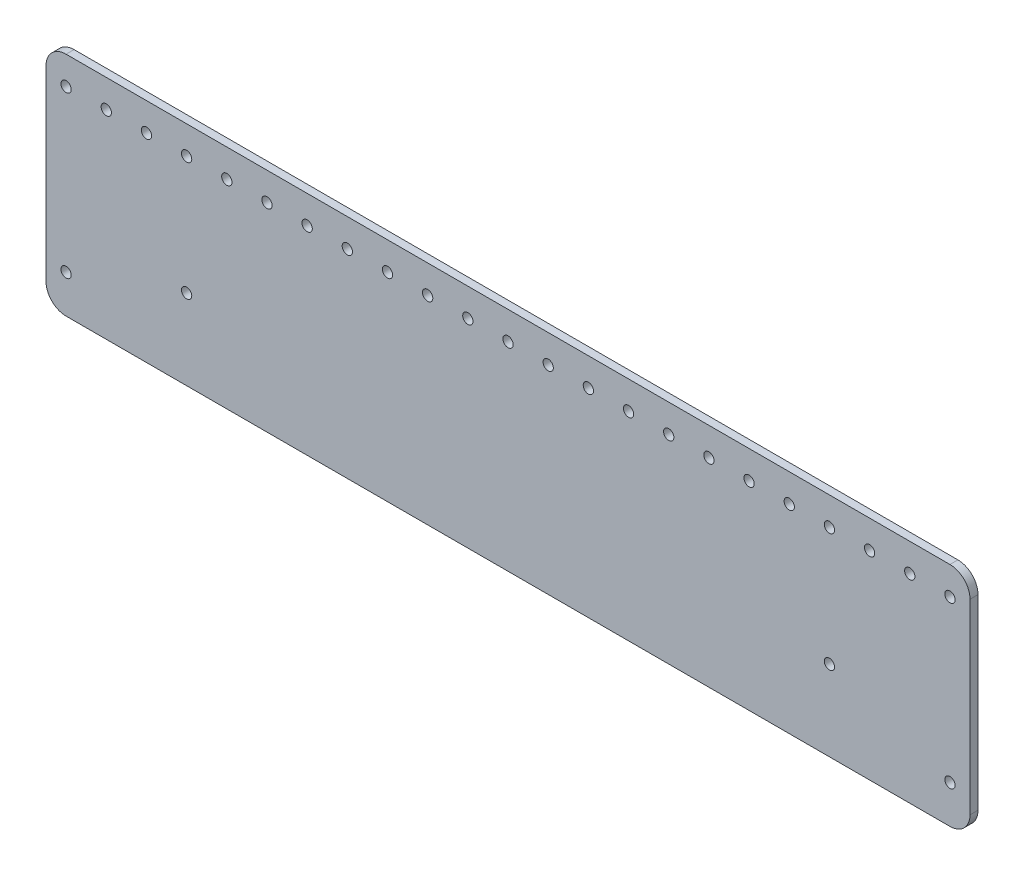
from build123d import *

# Parameters (mm, degrees)
SKETCH1_W           = 368
SKETCH1_H           = 90.35
SKETCH1_R           = 2.05
BOSS_EXTRUDE1_DEPTH = 3.175
SKETCH3_R           = 2.05
CUT_EXTRUDE1_DEPTH  = 3.18
FILLET1_R           = 8


with BuildPart() as part:
    # Sketch1 → Boss-Extrude1 (new body)
    with BuildSketch(Plane.XY):
        Rectangle(SKETCH1_W, SKETCH1_H)
        with Locations((-128, -13.175)):
            Circle(SKETCH1_R, mode=Mode.SUBTRACT)
        with Locations(Location((128, -13.175, 0), (0, 0, 180))):
            Circle(SKETCH1_R, mode=Mode.SUBTRACT)
    extrude(amount=BOSS_EXTRUDE1_DEPTH)

    # Sketch3 → Cut-Extrude1 (cut)
    with BuildSketch(Plane.XY.offset(3.175)):
        with Locations((-176, 34)):
            Circle(SKETCH3_R)
        with Locations((-160, 34)):
            Circle(SKETCH3_R)
        with Locations((-144, 34)):
            Circle(SKETCH3_R)
        with Locations((-128, 34)):
            Circle(SKETCH3_R)
        with Locations((-112, 34)):
            Circle(SKETCH3_R)
        with Locations((-96, 34)):
            Circle(SKETCH3_R)
        with Locations((-80, 34)):
            Circle(SKETCH3_R)
        with Locations((-64, 34)):
            Circle(SKETCH3_R)
        with Locations((-48, 34)):
            Circle(SKETCH3_R)
        with Locations((-32, 34)):
            Circle(SKETCH3_R)
        with Locations((-16, 34)):
            Circle(SKETCH3_R)
        with Locations((0, 34)):
            Circle(SKETCH3_R)
        with Locations((16, 34)):
            Circle(SKETCH3_R)
        with Locations((32, 34)):
            Circle(SKETCH3_R)
        with Locations((48, 34)):
            Circle(SKETCH3_R)
        with Locations((64, 34)):
            Circle(SKETCH3_R)
        with Locations((80, 34)):
            Circle(SKETCH3_R)
        with Locations((96, 34)):
            Circle(SKETCH3_R)
        with Locations((112, 34)):
            Circle(SKETCH3_R)
        with Locations((128, 34)):
            Circle(SKETCH3_R)
        with Locations((144, 34)):
            Circle(SKETCH3_R)
        with Locations((160, 34)):
            Circle(SKETCH3_R)
        with Locations((176, 34)):
            Circle(SKETCH3_R)
        with Locations((176, -30)):
            Circle(SKETCH3_R)
        with Locations((-176, -30)):
            Circle(SKETCH3_R)
    extrude(amount=-CUT_EXTRUDE1_DEPTH, mode=Mode.SUBTRACT)

    # Fillet1
    fillet1_edges = [part.edges().sort_by_distance(p)[0] for p in [
        (-184, 45.175, 1.5875),
        (184, 45.175, 1.5875),
        (184, -45.175, 1.5875),
        (-184, -45.175, 1.5875),
    ]]
    fillet(fillet1_edges, radius=FILLET1_R)


solid = part.part
